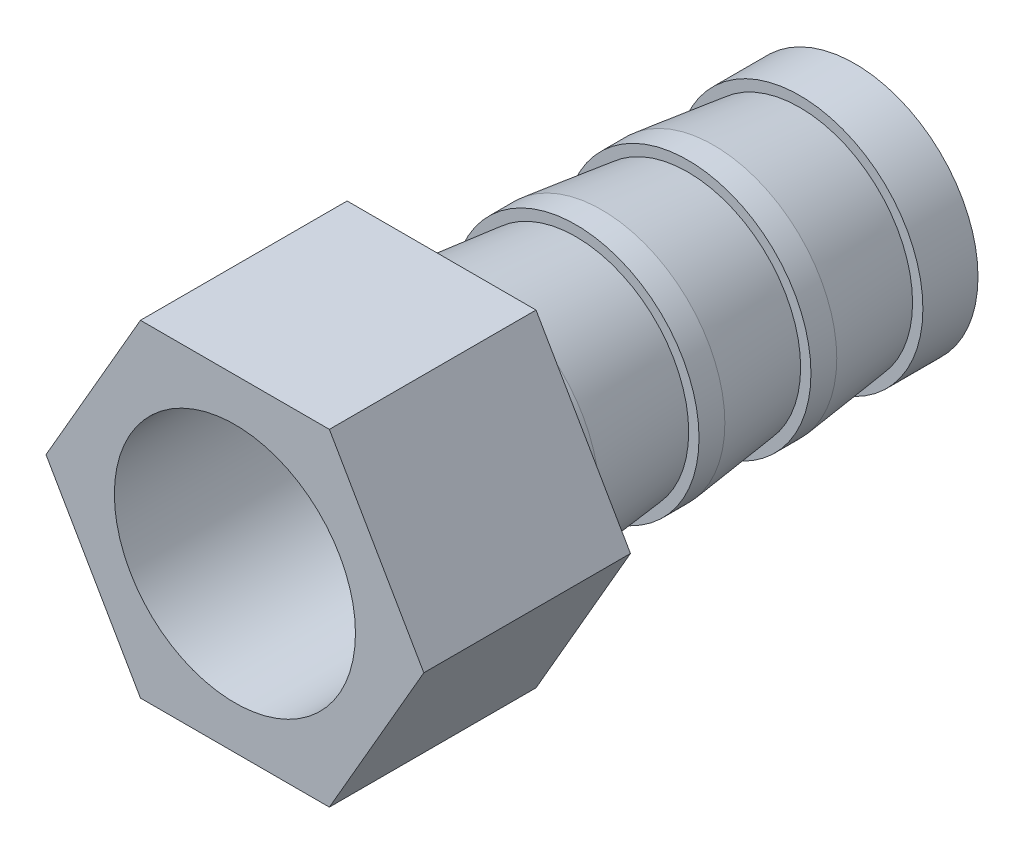
from build123d import *

# Parameters (mm, degrees)
SKETCH_1_R      = 7
EXTRUDE_1_DEPTH = 12


with BuildPart() as part:
    # 草图1 → 凸台-拉伸1 (new body)
    with BuildSketch(Plane.XY):
        Polygon((5.484827557, 9.5), (-5.484827557, 9.5), (-10.969655115, 0), (-5.484827557, -9.5), (5.484827557, -9.5), (10.969655115, 0), align=None)
        Circle(SKETCH_1_R, mode=Mode.SUBTRACT)
    extrude(amount=EXTRUDE_1_DEPTH)

    # 草图2 → 旋转1 (revolve)
    with BuildSketch(Plane(origin=(0, 0, 0), x_dir=(1, 0, 0), z_dir=(0, 1, 0)), mode=Mode.PRIVATE) as revolve_1_sk:
        Polygon((-7.15, 0), (-7.15, 2), (-6.55, 7.8), (-7.15, 7.8), (-7.15, 9.3), (-6.55, 14.3), (-7.15, 14.3), (-7.15, 15.8), (-6.55, 20.8), (-7.15, 20.8), (-7.15, 24), (-6, 24), (-6, 0), align=None)
    revolve(revolve_1_sk.sketch.rotate(Axis((0, 0, 0), (0, 0, -1)), 180), axis=Axis((0, 0, 0), (0, 0, -1)))


solid = part.part
